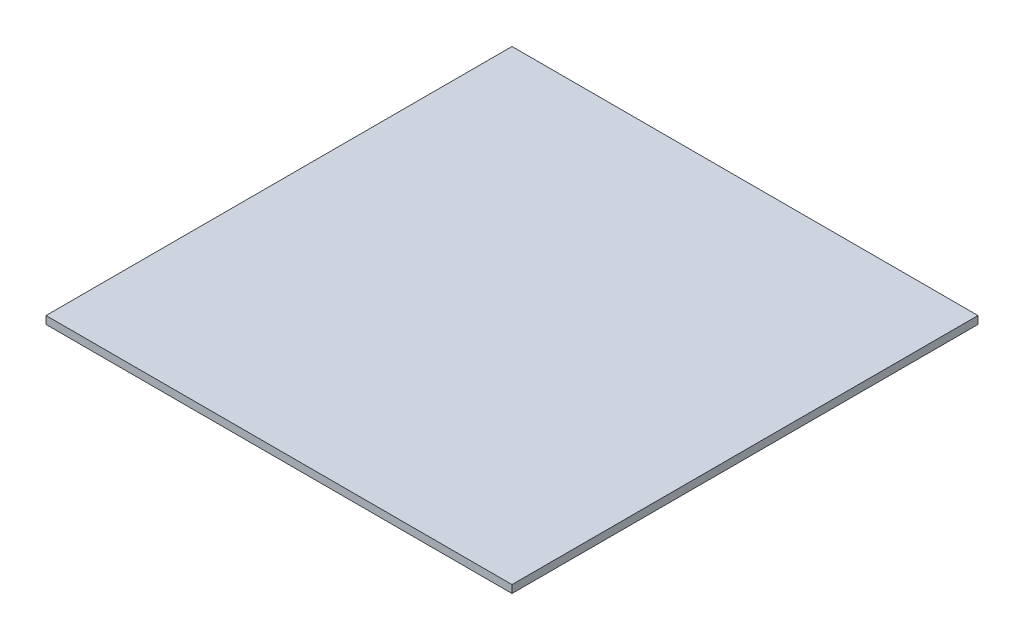
from build123d import *

# Parameters (mm, degrees)
SKETCH2_W           = 18
SKETCH2_H           = 18
BOSS_EXTRUDE1_DEPTH = 0.3


with BuildPart() as part:
    # Sketch2 → Boss-Extrude1 (new body)
    with BuildSketch(Plane(origin=(0, 0, 0), x_dir=(1, 0, 0), z_dir=(0, 1, 0))):
        Rectangle(SKETCH2_W, SKETCH2_H)
    extrude(amount=BOSS_EXTRUDE1_DEPTH)


solid = part.part
